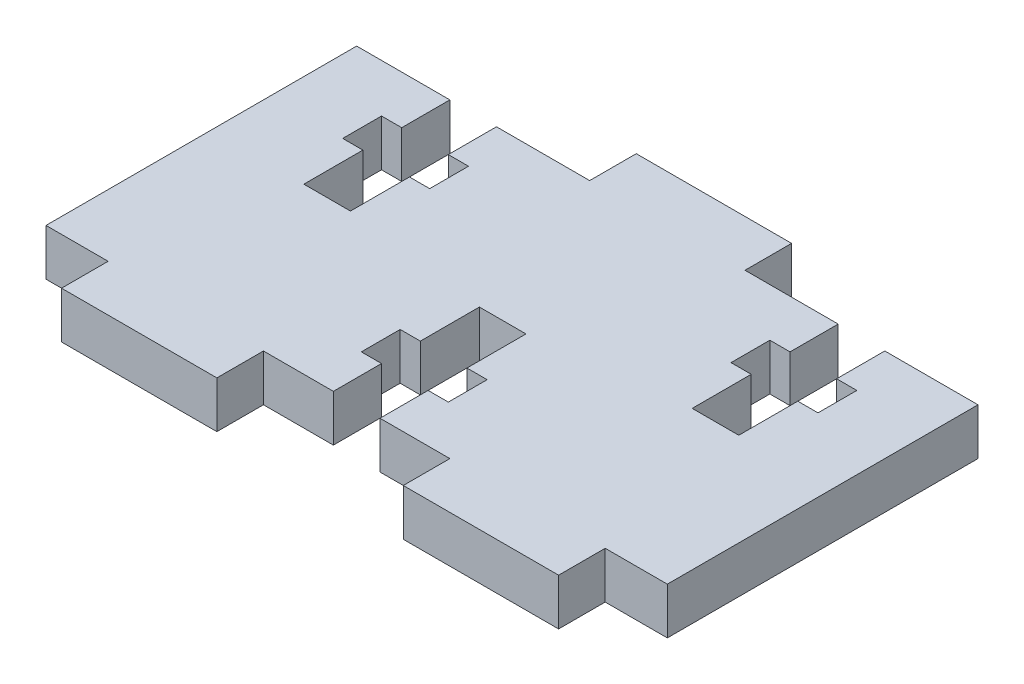
from build123d import *

# Parameters (mm, degrees)
BOSS_EXTRUDE2_DEPTH = 3


with BuildPart() as part:
    # Sketch2 → Boss-Extrude2 (new body)
    with BuildSketch(Plane(origin=(0, 0, 0), x_dir=(1, 0, 0), z_dir=(0, 1, 0))):
        Polygon((0, 0), (-4, 0), (-4, -3), (-14, -3), (-14, 0), (-18.5, 0), (-18.5, 3.1), (-17.2, 3.1), (-17.2, 5.6), (-18.5, 5.6), (-18.5, 9.4), (-21.5, 9.4), (-21.5, 5.6), (-22.8, 5.6), (-22.8, 3.1), (-21.5, 3.1), (-21.5, 0), (-26, 0), (-26, -3), (-36, -3), (-36, 0), (-40, 0), (-40, 20), (-34, 20), (-34, 16.9), (-35.3, 16.9), (-35.3, 14.4), (-34, 14.4), (-34, 10.6), (-31, 10.6), (-31, 14.4), (-29.7, 14.4), (-29.7, 16.9), (-31, 16.9), (-31, 20), (-25, 20), (-25, 23), (-15, 23), (-15, 20), (-9, 20), (-9, 16.9), (-10.3, 16.9), (-10.3, 14.4), (-9, 14.4), (-9, 10.6), (-6, 10.6), (-6, 14.4), (-4.7, 14.4), (-4.7, 16.9), (-6, 16.9), (-6, 20), (0, 20), align=None)
    extrude(amount=BOSS_EXTRUDE2_DEPTH)


solid = part.part
